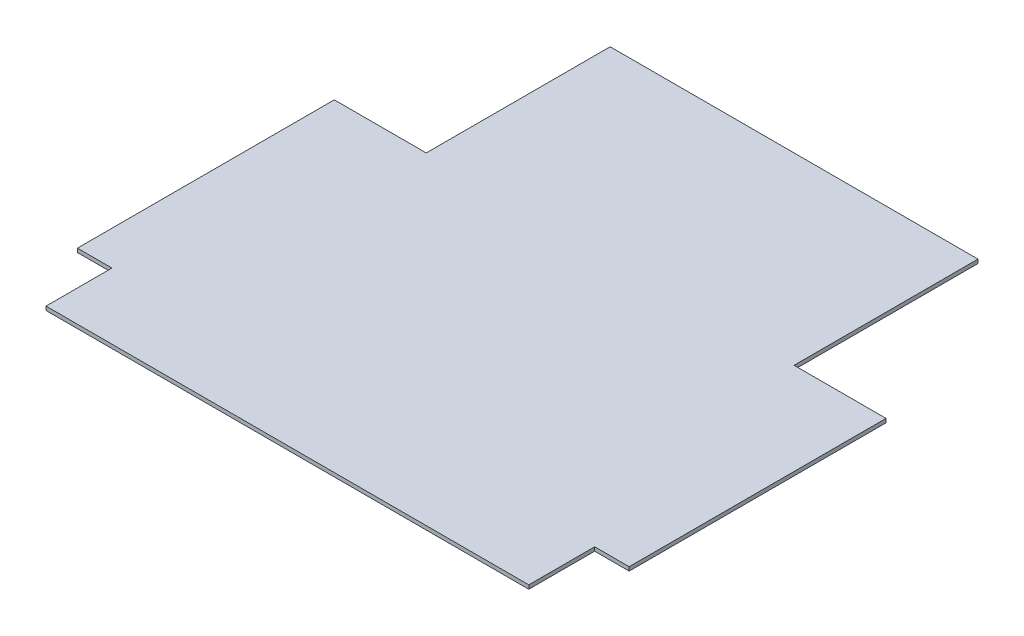
from build123d import *

# Parameters (mm, degrees)
BOSS_EXTRUDE1_DEPTH = 3.175


with BuildPart() as part:
    # Sketch1 → Boss-Extrude1 (new body)
    with BuildSketch(Plane(origin=(0, 0, 0), x_dir=(1, 0, 0), z_dir=(0, 1, 0))):
        Polygon((381, 212.852), (457.2, 212.852), (457.2, 0), (428.625, 0), (428.625, -54.61), (28.575, -54.61), (28.575, 0), (0, 0), (0, 212.852), (76.2, 212.852), (76.2, 365.252), (381, 365.252), align=None)
    extrude(amount=BOSS_EXTRUDE1_DEPTH)


solid = part.part
